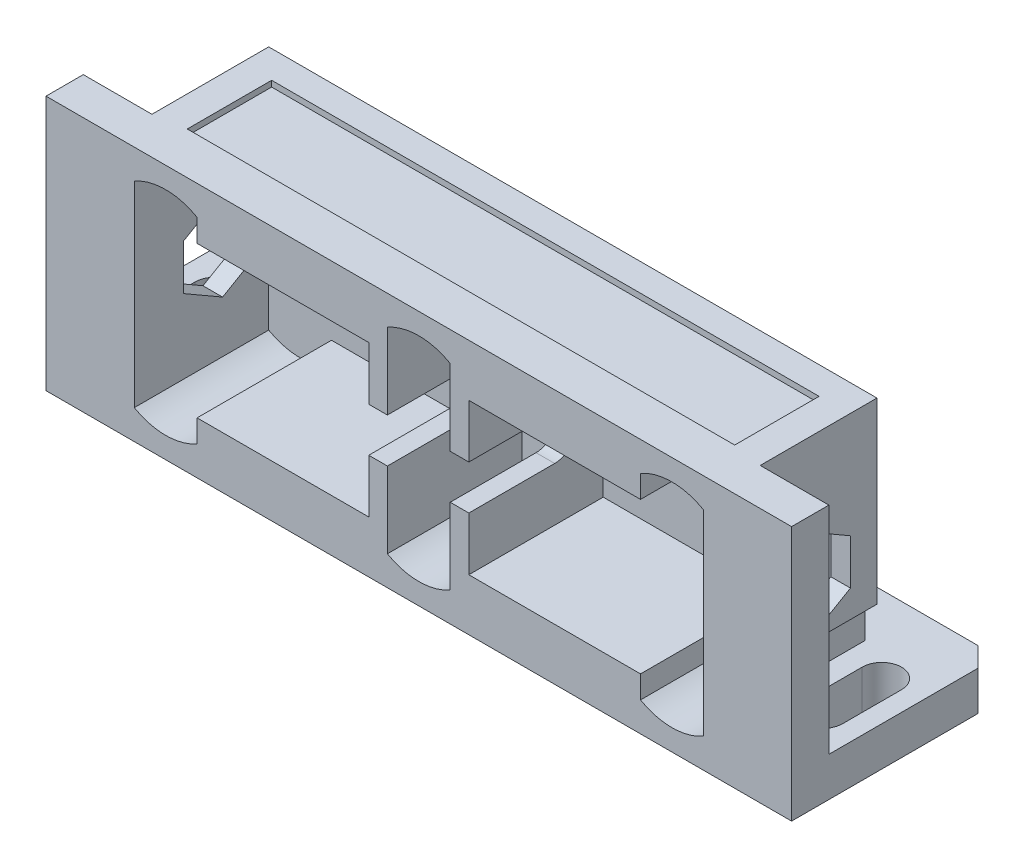
from build123d import *

# Parameters (mm, degrees)
SKETCH1_W           = 76
SKETCH1_H           = 21
BOSS_EXTRUDE1_DEPTH = 4
SKETCH2_W           = 76
SKETCH2_H           = 3.8
BOSS_EXTRUDE2_DEPTH = 26
SKETCH3_W           = 62
SKETCH3_H           = 22
BOSS_EXTRUDE3_DEPTH = 15.7
CHAMFER2_SIZE       = 2
SKETCH4_W           = 55.8
SKETCH4_H           = 8.6
CUT_EXTRUDE1_DEPTH  = 0.6
CUT_EXTRUDE2_DEPTH  = 46.14698218
SKETCH6_W           = 8
SKETCH6_H           = 4
CUT_EXTRUDE3_DEPTH  = 19.7
SKETCH7_W           = 58
SKETCH7_H           = 15.4
CUT_EXTRUDE4_DEPTH  = 13.7
CUT_EXTRUDE5_DEPTH  = 13.7
LPATTERN1_COUNT     = 3
LPATTERN1_PITCH     = 25.8
BOSS_EXTRUDE4_REACH = 52.606
SKETCH9_W           = 1.9
SKETCH9_H           = 15.4
CUT_EXTRUDE6_REACH  = 53.418
CUT_EXTRUDE7_REACH  = 76.48
SKETCH12_W          = 1.2
SKETCH12_H          = 3.8
CUT_EXTRUDE8_DEPTH  = 11.9


with BuildPart() as part:
    # Sketch1 → Boss-Extrude1 (new body)
    with BuildSketch(Plane(origin=(0, 0, 0), x_dir=(1, 0, 0), z_dir=(0, 1, 0))):
        Rectangle(SKETCH1_W, SKETCH1_H)
    extrude(amount=BOSS_EXTRUDE1_DEPTH)

    # Sketch2 → Boss-Extrude2 (add)
    with BuildSketch(Plane(origin=(0, 0, 0), x_dir=(1, 0, 0), z_dir=(0, 1, 0))):
        with Locations((0, -8.6)):
            Rectangle(SKETCH2_W, SKETCH2_H)
    extrude(amount=BOSS_EXTRUDE2_DEPTH)

    # Sketch3 → Boss-Extrude3 (add)
    with BuildSketch(Plane(origin=(0, 0, 10.5), x_dir=(-1, 0, 0), z_dir=(0, 0, -1))):
        with Locations((0, 15)):
            Rectangle(SKETCH3_W, SKETCH3_H)
    extrude(amount=BOSS_EXTRUDE3_DEPTH)

    # Chamfer2
    chamfer2_edges = [part.edges().sort_by_distance(p)[0] for p in [
        (-38, 2, -10.5),
        (38, 2, -10.5),
    ]]
    chamfer(chamfer2_edges, length=CHAMFER2_SIZE)

    # Sketch4 → Cut-Extrude1 (cut)
    with BuildSketch(Plane(origin=(0, 26, 0), x_dir=(1, 0, 0), z_dir=(0, 1, 0))):
        with Locations((0, -1.9)):
            Rectangle(SKETCH4_W, SKETCH4_H)
    extrude(amount=-CUT_EXTRUDE1_DEPTH, mode=Mode.SUBTRACT)

    # Sketch5 → Cut-Extrude2 (cut, through all)
    with BuildSketch(Plane(origin=(0, 4, 0), x_dir=(1, 0, 0), z_dir=(0, 1, 0))):
        with BuildLine():
            Line((-32, 2.7), (-32, -3.3))
            ThreePointArc((-32, -3.3), (-34, -5.3), (-36, -3.3))
            Line((-36, -3.3), (-36, 2.7))
            ThreePointArc((-36, 2.7), (-34, 4.7), (-32, 2.7))
        make_face()
        with BuildLine():
            Line((32, 2.7), (32, -3.3))
            ThreePointArc((32, -3.3), (34, -5.3), (36, -3.3))
            Line((36, -3.3), (36, 2.7))
            ThreePointArc((36, 2.7), (34, 4.7), (32, 2.7))
        make_face()
    extrude(amount=-CUT_EXTRUDE2_DEPTH, mode=Mode.SUBTRACT)

    # Sketch6 → Cut-Extrude3 (cut)
    with BuildSketch(Plane(origin=(0, 0, -10.5), x_dir=(-1, 0, 0), z_dir=(0, 0, -1))):
        with Locations((-12.75, 3.1)):
            Rectangle(SKETCH6_W, SKETCH6_H)
        with Locations((12.75, 3.1)):
            Rectangle(SKETCH6_W, SKETCH6_H)
    extrude(amount=-CUT_EXTRUDE3_DEPTH, mode=Mode.SUBTRACT)

    # Sketch7 → Cut-Extrude4 (cut)
    with BuildSketch(Plane.XY.offset(10.5)):
        with Locations((0, 13)):
            Rectangle(SKETCH7_W, SKETCH7_H)
    extrude(amount=-CUT_EXTRUDE4_DEPTH, mode=Mode.SUBTRACT)

    # Sketch8 → Cut-Extrude5 (cut)
    with BuildSketch(Plane.XY.offset(10.5)):
        with BuildLine():
            Line((-29, 23), (-29, 3))
            ThreePointArc((-29, 3), (-25.8, 2.15), (-22.6, 3))
            Line((-22.6, 3), (-22.6, 23))
            ThreePointArc((-22.6, 23), (-25.8, 23.85), (-29, 23))
        make_face()
    cut_extrude5 = extrude(amount=-CUT_EXTRUDE5_DEPTH, mode=Mode.SUBTRACT)

    # LPattern1: Cut-Extrude5 ×3
    with Locations(*[(i * LPATTERN1_PITCH, 0, 0) for i in range(1, LPATTERN1_COUNT)]):
        add(cut_extrude5, mode=Mode.SUBTRACT)

    # Sketch9 → Boss-Extrude4 (add, up to next)
    with BuildSketch(Plane.XY.offset(10.5), mode=Mode.PRIVATE) as boss_extrude4_sk1:
        with Locations((-4.15, 13)):
            Rectangle(SKETCH9_W, SKETCH9_H)
    boss_extrude4_tool1 = extrude(boss_extrude4_sk1.sketch, amount=-BOSS_EXTRUDE4_REACH, mode=Mode.PRIVATE) - part.part
    # Sketch9 → Boss-Extrude4 (add, up to next)
    with BuildSketch(Plane.XY.offset(10.5), mode=Mode.PRIVATE) as boss_extrude4_sk2:
        with Locations((4.15, 13)):
            Rectangle(SKETCH9_W, SKETCH9_H)
    boss_extrude4_tool2 = extrude(boss_extrude4_sk2.sketch, amount=-BOSS_EXTRUDE4_REACH, mode=Mode.PRIVATE) - part.part
    add(boss_extrude4_tool1.solids().sort_by_distance((-4.15, 13, 10.5))[0])
    add(boss_extrude4_tool2.solids().sort_by_distance((4.15, 13, 10.5))[0])

    # Cut-Extrude6: up to this face of the body (flat: up to its plane)
    cut_extrude6_end = Plane(part.part.faces().sort_by_distance((5.1, 13, 3.65))[0])
    # Sketch10 → Cut-Extrude6 (cut, up to the picked face)
    with BuildSketch(Plane.ZY.offset(5.1), mode=Mode.PRIVATE) as cut_extrude6_sk1:
        with BuildLine():
            Line((10.5, 15.25), (1.75, 15.25))
            ThreePointArc((1.75, 15.25), (-0.5, 13), (1.75, 10.75))
            Line((1.75, 10.75), (10.5, 10.75))
            Line((10.5, 10.75), (10.5, 15.25))
        make_face()
    cut_extrude6_tool1 = split(extrude(cut_extrude6_sk1.sketch, amount=-CUT_EXTRUDE6_REACH, mode=Mode.PRIVATE), bisect_by=cut_extrude6_end, keep=Keep.BOTH, mode=Mode.PRIVATE)
    add(cut_extrude6_tool1.solids().sort_by(Axis((-5.1, 13, 5.229437), (1, 0, 0)))[0], mode=Mode.SUBTRACT)

    # Sketch11 → Cut-Extrude7 (cut, up to next)
    with BuildSketch(Plane.ZY.offset(31), mode=Mode.PRIVATE) as cut_extrude7_sk1:
        Polygon((1.5, 17.5), (-2.5, 15.190598923), (-2.5, 10.57179677), (1.5, 8.262395693), (5.5, 10.57179677), (5.5, 15.190598923), align=None)
    cut_extrude7_tool1 = extrude(cut_extrude7_sk1.sketch, amount=-CUT_EXTRUDE7_REACH, mode=Mode.PRIVATE) & part.part
    cut_extrude7 = cut_extrude7_tool1.solids().sort_by_distance((-31, 12.881198, 1.5))[0]
    add(cut_extrude7, mode=Mode.SUBTRACT)

    # Mirror1: Cut-Extrude7 across plane
    add(cut_extrude7.mirror(Plane(origin=(0, 0, 0), x_dir=(0, 0, 1), z_dir=(1, 0, 0))), mode=Mode.SUBTRACT)

    # Sketch12 → Cut-Extrude8 (cut)
    with BuildSketch(Plane(origin=(0, 0, -5.2), x_dir=(-1, 0, 0), z_dir=(0, 0, -1))):
        with Locations((-30.4, 5.9)):
            Rectangle(SKETCH12_W, SKETCH12_H)
        with Locations((30.4, 5.9)):
            Rectangle(SKETCH12_W, SKETCH12_H)
    extrude(amount=-CUT_EXTRUDE8_DEPTH, mode=Mode.SUBTRACT)


solid = part.part
